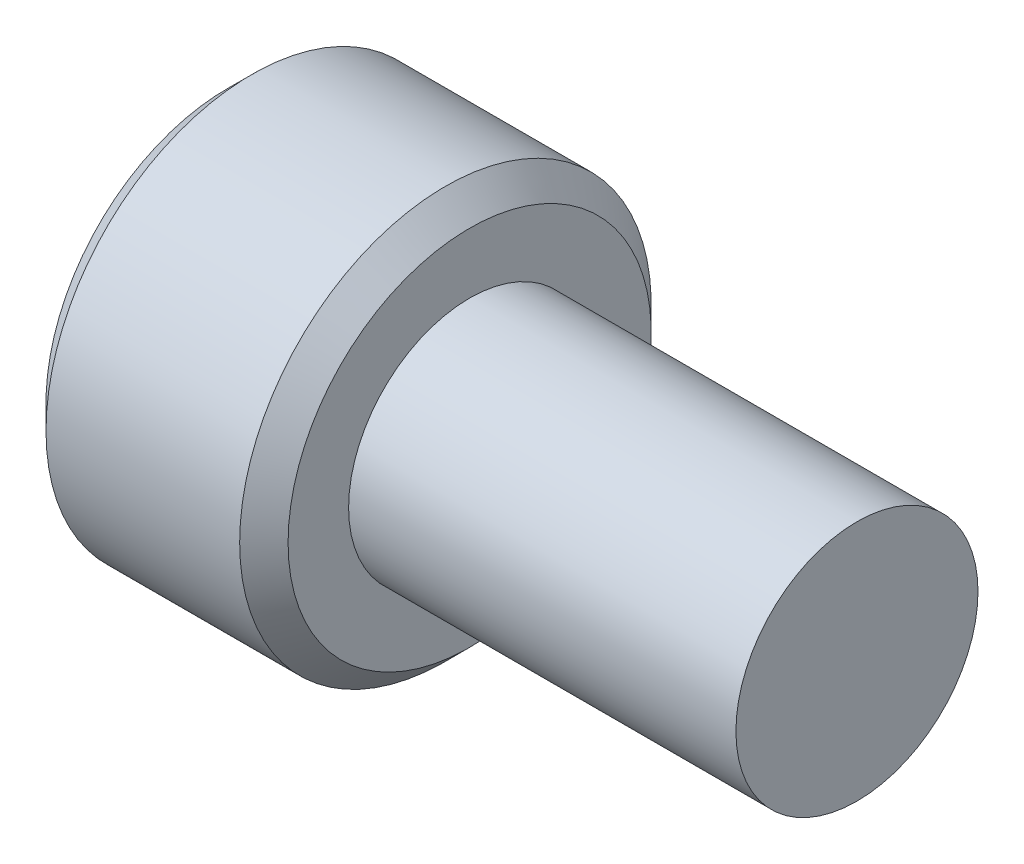
from build123d import *

# Parameters (mm, degrees)
CUT_EXTRUDE1_DEPTH = 2
CHAMFER1_SIZE      = 0.5


with BuildPart() as part:
    # Sketch1 → Revolve1 (revolve)
    with BuildSketch(Plane.XY, mode=Mode.PRIVATE) as revolve1_sk:
        Polygon((0, 2.5), (8, 2.5), (8, 0), (-5, 0), (-5, 4.25), (0, 4.25), align=None)
    revolve(revolve1_sk.sketch.rotate(Axis((-10.4, 0, 0), (1, 0, 0)), 90), axis=Axis((-10.4, 0, 0), (1, 0, 0)))

    # Sketch2 → Cut-Revolve1 (revolve, cut)
    with BuildSketch(Plane.XY, mode=Mode.PRIVATE) as cut_revolve1_sk:
        Polygon((-1.798278762, 0), (-3, 2), (-5, 2), (-5, 0), align=None)
    revolve(cut_revolve1_sk.sketch.rotate(Axis((-10.4, 0, 0), (1, 0, 0)), 90), axis=Axis((-10.4, 0, 0), (1, 0, 0)), mode=Mode.SUBTRACT)

    # Sketch3 → Cut-Extrude1 (cut)
    with BuildSketch(Plane.ZY.offset(5)):
        Polygon((2, 1.154700538), (0, 2.309401077), (-2, 1.154700538), (-2, -1.154700538), (0, -2.309401077), (2, -1.154700538), align=None)
    extrude(amount=-CUT_EXTRUDE1_DEPTH, mode=Mode.SUBTRACT)

    # Chamfer1
    chamfer1_edges = [part.edges().sort_by_distance(p)[0] for p in [
        (-5, 0, -4.25),
        (0, 0, -4.25),
    ]]
    chamfer(chamfer1_edges, length=CHAMFER1_SIZE)


solid = part.part
